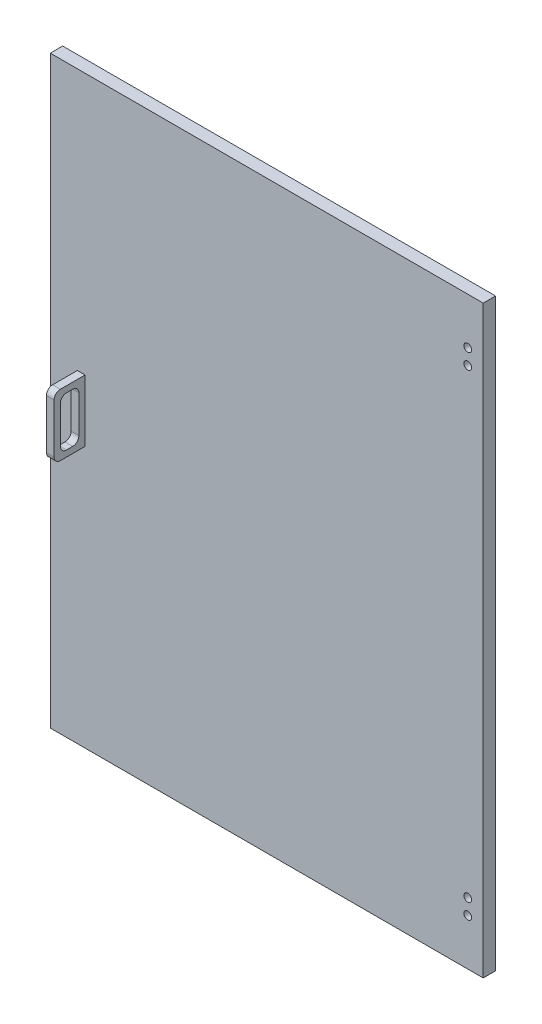
from build123d import *

# Parameters (mm, degrees)
SKETCH1_W           = 177.8
SKETCH1_H           = 240.03
BOSS_EXTRUDE1_DEPTH = 5.08
SKETCH2_R           = 1.5875
CUT_EXTRUDE1_DEPTH  = 150.441013865
SKETCH3_W           = 3.175
SKETCH3_H           = 25.4
BOSS_EXTRUDE2_DEPTH = 12.7
SKETCH4_W           = 7.62
SKETCH4_H           = 20.32
CUT_EXTRUDE2_DEPTH  = 204.227035311
FILLET1_R           = 2.54


with BuildPart() as part:
    # Sketch1 → Boss-Extrude1 (new body)
    with BuildSketch(Plane.XY):
        Rectangle(SKETCH1_W, SKETCH1_H)
    extrude(amount=-BOSS_EXTRUDE1_DEPTH)

    # Sketch2 → Cut-Extrude1 (cut, through all)
    with BuildSketch(Plane.XY):
        with Locations((82.55, 100.965)):
            Circle(SKETCH2_R)
        with Locations((82.55, 94.615)):
            Circle(SKETCH2_R)
        with Locations(Location((82.55, -94.615, 0), (0, 0, 180))):
            Circle(SKETCH2_R)
        with Locations(Location((82.55, -100.965, 0), (0, 0, 180))):
            Circle(SKETCH2_R)
    extrude(amount=-CUT_EXTRUDE1_DEPTH, mode=Mode.SUBTRACT)

    # Sketch3 → Boss-Extrude2 (add)
    with BuildSketch(Plane.XY):
        with Locations((-76.2, 0)):
            Rectangle(SKETCH3_W, SKETCH3_H)
    extrude(amount=BOSS_EXTRUDE2_DEPTH)

    # Sketch4 → Cut-Extrude2 (cut, through all)
    with BuildSketch(Plane(origin=(-74.6125, 0, 0), x_dir=(0, 0, -1), z_dir=(1, 0, 0))):
        with Locations((-6.35, 0)):
            Rectangle(SKETCH4_W, SKETCH4_H)
    extrude(amount=-CUT_EXTRUDE2_DEPTH, mode=Mode.SUBTRACT)

    # Fillet1
    fillet1_edges = [part.edges().sort_by_distance(p)[0] for p in [
        (-76.2, 12.7, 12.7),
        (-76.2, -12.7, 12.7),
        (-76.2, 10.16, 2.54),
        (-76.2, -10.16, 2.54),
        (-76.2, -10.16, 10.16),
        (-76.2, 10.16, 10.16),
    ]]
    fillet(fillet1_edges, radius=FILLET1_R)


solid = part.part
